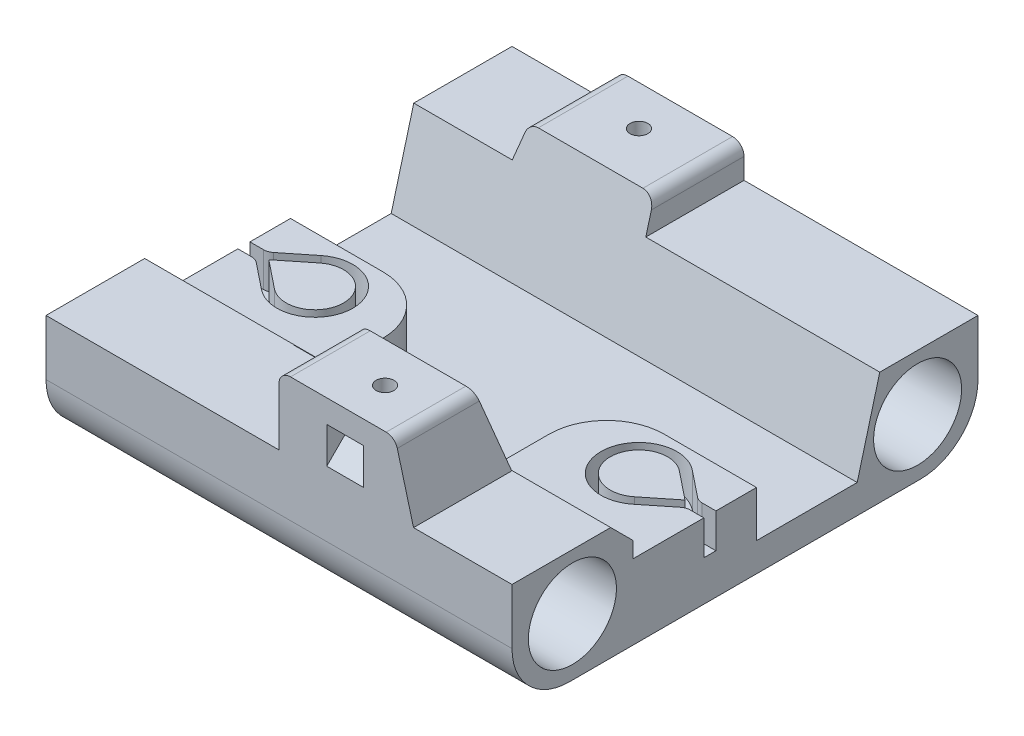
from build123d import *
from build123d.topology import SkipClean

# Parameters (mm, degrees)
SKETCH1_W                = 81
SKETCH1_H                = 81
BOSS_EXTRUDE1_DEPTH      = 5
BOSS_EXTRUDE3_DEPTH      = 81
SKETCH4_R                = 7.65
CUT_EXTRUDE2_DEPTH       = 93.668077028
BOSS_EXTRUDE4_DEPTH      = 10
BOSS_EXTRUDE6_DEPTH      = 26.053662708
CHAMFER1_SIZE            = 3.85
CHAMFER1_OF_MIRROR1_SIZE = 3.85
FILLET2_R                = 2
FILLET3_R                = 10
SKETCH8_R                = 7.65
SKETCH8_R_2              = 6
BOSS_EXTRUDE7_DEPTH      = 16.5
BOSS_EXTRUDE8_REACH      = 94.668
BOSS_EXTRUDE9_REACH      = 97.932
SKETCH11_R               = 1.55
CUT_EXTRUDE3_DEPTH       = 15
CUT_EXTRUDE4_DEPTH       = 2
BOSS_EXTRUDE10_START     = 2
BOSS_EXTRUDE10_DEPTH     = 2
FILLET4_R                = 10
CUT_EXTRUDE5_REACH       = 97.932
FILLET5_R                = 2
FILLET6_R                = 2
FILLET7_R                = 2
CUT_EXTRUDE6_DEPTH       = 2.5
CHAMFER2_SIZE            = 3.8
CUT_EXTRUDE7_REACH       = 97.932
SKETCH17_W               = 23.385
SKETCH17_H               = 12
CUT_EXTRUDE8_REACH       = 97.932
SKETCH19_W               = 23.550689655
SKETCH19_H               = 12
FILLET8_R                = 2


with BuildPart() as part:
    # Sketch1 → Boss-Extrude1 (new body)
    with BuildSketch(Plane(origin=(0, 0, 0), x_dir=(1, 0, 0), z_dir=(0, 1, 0))):
        Rectangle(SKETCH1_W, SKETCH1_H)
    extrude(amount=BOSS_EXTRUDE1_DEPTH)

    # Sketch2 → Boss-Extrude3 (add)
    with BuildSketch(Plane.ZY.offset(40.5)):
        with BuildLine():
            Line((-24.210138171, 5), (-19.5, 5))
            Line((-19.5, 5), (-23.425455669, 19.65))
            Line((-23.425455669, 19.65), (-40.5, 19.65))
            Line((-40.5, 19.65), (-40.5, 5))
            Line((-40.5, 5), (-35.789861829, 5))
            ThreePointArc((-35.789861829, 5), (-32.667401077, 17.169900383), (-22.35, 10))
            ThreePointArc((-22.35, 10), (-22.830099617, 7.332598923), (-24.210138171, 5))
        make_face()
        with BuildLine():
            Line((23.425455669, 19.65), (19.5, 5))
            Line((19.5, 5), (24.210138171, 5))
            ThreePointArc((24.210138171, 5), (27.332598923, 17.169900383), (37.65, 10))
            ThreePointArc((37.65, 10), (37.169900383, 7.332598923), (35.789861829, 5))
            Line((35.789861829, 5), (40.5, 5))
            Line((40.5, 5), (40.5, 19.65))
            Line((40.5, 19.65), (23.425455669, 19.65))
        make_face()
    extrude(amount=-BOSS_EXTRUDE3_DEPTH)

    # Sketch4 → Cut-Extrude2 (cut, through all)
    with SkipClean():  # the faces are left unmerged after this step: merging them gives an invalid solid
        with BuildSketch(Plane.ZY.offset(40.5)):
            with Locations((-30, 10)):
                Circle(SKETCH4_R)
            with Locations((30, 10)):
                Circle(SKETCH4_R)
        extrude(amount=-CUT_EXTRUDE2_DEPTH, mode=Mode.SUBTRACT)

    # Sketch6 → Boss-Extrude4 (add)
    with SkipClean():  # the faces are left unmerged after this step: merging them gives an invalid solid
        with BuildSketch(Plane(origin=(0, 5, 0), x_dir=(1, 0, 0), z_dir=(0, 1, 0))):
            with BuildLine():
                Line((-32.290875523, -0.947876651), (-37.414425943, -5.05))
                Line((-37.414425943, -5.05), (-40.5, -5.05))
                Line((-40.5, -5.05), (-40.5, 2))
                Line((-40.5, 2), (-14.446337292, 2))
                Line((-14.446337292, 2), (-14.446337292, -19.5))
                Line((-14.446337292, -19.5), (-40.5, -19.5))
                Line((-40.5, -19.5), (-40.5, -7.15))
                Line((-40.5, -7.15), (-37.414425943, -7.15))
                Line((-37.414425943, -7.15), (-32.290875523, -11.252123349))
                ThreePointArc((-32.290875523, -11.252123349), (-21.565875523, -6.1), (-32.290875523, -0.947876651))
            make_face()
            with BuildLine():
                Line((-31.290875523, -2.196876251), (-36.165875523, -6.1))
                Line((-36.165875523, -6.1), (-31.290875523, -10.003123749))
                ThreePointArc((-31.290875523, -10.003123749), (-23.165875523, -6.1), (-31.290875523, -2.196876251))
            make_face()
        boss_extrude4 = extrude(amount=BOSS_EXTRUDE4_DEPTH)

    # Sketch7 → Boss-Extrude6 (add)
    with SkipClean():  # the faces are left unmerged after this step: merging them gives an invalid solid
        with BuildSketch(Plane.ZY.offset(40.5)):
            Polygon((19.5, 5), (19.5, 19.65), (23.425455669, 19.65), align=None)
        boss_extrude6 = extrude(amount=-BOSS_EXTRUDE6_DEPTH)

    # Chamfer1
    chamfer1_edges = [part.edges().sort_by_distance(p)[0] for p in [
        (-27.473168646, 19.65, 19.5),
    ]]
    chamfer(chamfer1_edges, length=CHAMFER1_SIZE)

    # Mirror1: Boss-Extrude4, Boss-Extrude6 across plane
    with SkipClean():  # the faces are left unmerged after this step: merging them gives an invalid solid
        add(boss_extrude4.mirror(Plane.ZY))
        add(boss_extrude6.mirror(Plane.ZY))

    # Chamfer1 of Mirror1
    chamfer1_of_mirror1_edges = [part.edges().sort_by_distance(p)[0] for p in [
        (27.473168646, 19.65, 19.5),
    ]]
    chamfer(chamfer1_of_mirror1_edges, length=CHAMFER1_OF_MIRROR1_SIZE)

    # Fillet2
    fillet2_edges = [part.edges().sort_by_distance(p)[0] for p in [
        (37.414425943, 10, 7.15),
        (37.414425943, 10, 5.05),
        (-37.414425943, 10, 7.15),
        (-37.414425943, 10, 5.05),
    ]]
    fillet(fillet2_edges, radius=FILLET2_R)

    # Fillet3
    fillet3_edges = [part.edges().sort_by_distance(p)[0] for p in [
        (0, 0, 40.5),
        (0, 0, -40.5),
    ]]
    fillet(fillet3_edges, radius=FILLET3_R)

    # Sketch8 → Boss-Extrude7 (add, symmetric)
    # profile 1 of 2: a face of its own
    with SkipClean():  # the faces are left unmerged after this step: merging them gives an invalid solid
        with BuildSketch(Plane.ZY):
            with Locations((30, 10)):
                Circle(SKETCH8_R)
            with Locations((30, 10)):
                Circle(SKETCH8_R_2, mode=Mode.SUBTRACT)
        # profile 2 of 2: a face of its own
        with BuildSketch(Plane.ZY):
            with Locations((-30, 10)):
                Circle(SKETCH8_R)
            with Locations((-30, 10)):
                Circle(SKETCH8_R_2, mode=Mode.SUBTRACT)
        extrude(amount=BOSS_EXTRUDE7_DEPTH, both=True)

    # Boss-Extrude8: up to this plane
    with SkipClean():  # the faces are left unmerged after this step: merging them gives an invalid solid
        boss_extrude8_end = Plane(origin=(66.10512644, -4.540063509, 16.943747687), z_dir=(0, -0.25881904510252485, 0.9659258262890673))
        # Sketch9 → Boss-Extrude8 (add, up to the surface)
        with BuildSketch(Plane.XY.offset(40.5), mode=Mode.PRIVATE) as boss_extrude8_sk1:
            Polygon((-20.165689655, 31.65), (-23.385, 19.65), (23.385, 19.65), (20.165689655, 31.65), align=None)
        boss_extrude8_tool1 = split(extrude(boss_extrude8_sk1.sketch, amount=-BOSS_EXTRUDE8_REACH, mode=Mode.PRIVATE), bisect_by=boss_extrude8_end, keep=Keep.BOTH, mode=Mode.PRIVATE)
        add(boss_extrude8_tool1.solids().sort_by_distance((0, 25.502158, 40.5))[0])

    # Boss-Extrude9: up to this plane
    with SkipClean():  # the faces are left unmerged after this step: merging them gives an invalid solid
        boss_extrude9_end = Plane(origin=(66.10512644, -4.540063509, -16.943747687), z_dir=(0, 0.25881904510252485, 0.9659258262890673))
        # Sketch10 → Boss-Extrude9 (add, up to the surface)
        with BuildSketch(Plane(origin=(0, 0, -40.5), x_dir=(-1, 0, 0), z_dir=(0, 0, -1)), mode=Mode.PRIVATE) as boss_extrude9_sk1:
            Polygon((23.385, 19.65), (20.165689655, 31.65), (-20.165689655, 31.65), (-23.385, 19.65), align=None)
        boss_extrude9_tool1 = split(extrude(boss_extrude9_sk1.sketch, amount=-BOSS_EXTRUDE9_REACH, mode=Mode.PRIVATE), bisect_by=boss_extrude9_end, keep=Keep.BOTH, mode=Mode.PRIVATE)
        add(boss_extrude9_tool1.solids().sort_by_distance((0, 25.502158, -40.5))[0])

    # Sketch11 → Cut-Extrude3 (cut)
    with SkipClean():  # the faces are left unmerged after this step: merging them gives an invalid solid
        with BuildSketch(Plane(origin=(0, 31.65, 0), x_dir=(1, 0, 0), z_dir=(0, 1, 0))):
            with Locations(Location((-11.5, 33.570422989, 0), (0, 0, 270))):
                Circle(SKETCH11_R)
            with BuildLine():
                ThreePointArc((13.05, -33.570422989), (11.5, -32.020422989), (9.95, -33.570422989))
                Line((9.95, -33.570422989), (13.05, -33.570422989))
            make_face()
            with BuildLine():
                Line((13.05, -33.570422989), (9.95, -33.570422989))
                ThreePointArc((9.95, -33.570422989), (11.5, -35.120422989), (13.05, -33.570422989))
            make_face()
        extrude(amount=-CUT_EXTRUDE3_DEPTH, mode=Mode.SUBTRACT)

    # Sketch12 → Cut-Extrude4 (cut)
    with SkipClean():  # the faces are left unmerged after this step: merging them gives an invalid solid
        with BuildSketch(Plane(origin=(0, 15, 0), x_dir=(1, 0, 0), z_dir=(0, 1, 0))):
            with BuildLine():
                Line((31.290875523, -10.003123749), (36.165875523, -6.1))
                Line((36.165875523, -6.1), (31.290875523, -2.196876251))
                ThreePointArc((31.290875523, -2.196876251), (23.165875523, -6.1), (31.290875523, -10.003123749))
            make_face()
            with BuildLine():
                Line((-36.165875523, -6.1), (-31.290875523, -10.003123749))
                ThreePointArc((-31.290875523, -10.003123749), (-23.165875523, -6.1), (-31.290875523, -2.196876251))
                Line((-31.290875523, -2.196876251), (-36.165875523, -6.1))
            make_face()
            with BuildLine():
                Line((32.290875523, -0.947876651), (36.866426744, -4.6112495))
                ThreePointArc((36.866426744, -4.6112495), (37.454044301, -4.937127314), (38.116426744, -5.05))
                Line((38.116426744, -5.05), (40.5, -5.05))
                Line((40.5, -5.05), (40.5, 2))
                Line((40.5, 2), (14.446337292, 2))
                Line((14.446337292, 2), (14.446337292, -19.5))
                Line((14.446337292, -19.5), (40.5, -19.5))
                Line((40.5, -19.5), (40.5, -7.15))
                Line((40.5, -7.15), (38.116426744, -7.15))
                ThreePointArc((38.116426744, -7.15), (37.454044301, -7.262872686), (36.866426744, -7.5887505))
                Line((36.866426744, -7.5887505), (32.290875523, -11.252123349))
                ThreePointArc((32.290875523, -11.252123349), (21.565875523, -6.1), (32.290875523, -0.947876651))
            make_face()
            with BuildLine():
                Line((-32.290875523, -11.252123349), (-36.866426744, -7.5887505))
                ThreePointArc((-36.866426744, -7.5887505), (-37.454044301, -7.262872686), (-38.116426744, -7.15))
                Line((-38.116426744, -7.15), (-40.5, -7.15))
                Line((-40.5, -7.15), (-40.5, -19.5))
                Line((-40.5, -19.5), (-14.446337292, -19.5))
                Line((-14.446337292, -19.5), (-14.446337292, 2))
                Line((-14.446337292, 2), (-40.5, 2))
                Line((-40.5, 2), (-40.5, -5.05))
                Line((-40.5, -5.05), (-38.116426744, -5.05))
                ThreePointArc((-38.116426744, -5.05), (-37.454044301, -4.937127314), (-36.866426744, -4.6112495))
                Line((-36.866426744, -4.6112495), (-32.290875523, -0.947876651))
                ThreePointArc((-32.290875523, -0.947876651), (-21.565875523, -6.1), (-32.290875523, -11.252123349))
            make_face()
        extrude(amount=-CUT_EXTRUDE4_DEPTH, mode=Mode.SUBTRACT)

    # Sketch13 → Boss-Extrude10 (add)
    with SkipClean():  # the faces are left unmerged after this step: merging them gives an invalid solid
        with BuildSketch(Plane(origin=(0, 5, 0), x_dir=(1, 0, 0), z_dir=(0, 1, 0)).offset(BOSS_EXTRUDE10_START)):
            with BuildLine():
                Line((32.290875523, -11.252123349), (36.866426744, -7.5887505))
                ThreePointArc((36.866426744, -7.5887505), (37.454044301, -7.262872686), (38.116426744, -7.15))
                Line((38.116426744, -7.15), (40.5, -7.15))
                Line((40.5, -7.15), (40.5, -5.05))
                Line((40.5, -5.05), (38.116426744, -5.05))
                ThreePointArc((38.116426744, -5.05), (37.454044301, -4.937127314), (36.866426744, -4.6112495))
                Line((36.866426744, -4.6112495), (32.290875523, -0.947876651))
                ThreePointArc((32.290875523, -0.947876651), (21.565875523, -6.1), (32.290875523, -11.252123349))
            make_face()
            with BuildLine():
                Line((-40.5, -7.15), (-38.116426744, -7.15))
                ThreePointArc((-38.116426744, -7.15), (-37.454044301, -7.262872686), (-36.866426744, -7.5887505))
                Line((-36.866426744, -7.5887505), (-32.290875523, -11.252123349))
                ThreePointArc((-32.290875523, -11.252123349), (-21.565875523, -6.1), (-32.290875523, -0.947876651))
                Line((-32.290875523, -0.947876651), (-36.866426744, -4.6112495))
                ThreePointArc((-36.866426744, -4.6112495), (-37.454044301, -4.937127314), (-38.116426744, -5.05))
                Line((-38.116426744, -5.05), (-40.5, -5.05))
                Line((-40.5, -5.05), (-40.5, -7.15))
            make_face()
        extrude(amount=-BOSS_EXTRUDE10_DEPTH)

    # Fillet4
    fillet4_edges = [part.edges().sort_by_distance(p)[0] for p in [
        (14.446337292, 9, -2),
        (-14.446337292, 9, -2),
    ]]
    fillet(fillet4_edges, radius=FILLET4_R)

    # Cut-Extrude5: up to this plane
    with SkipClean():  # the faces are left unmerged after this step: merging them gives an invalid solid
        cut_extrude5_end = Plane(origin=(66.10512644, -4.540063509, -16.943747687), z_dir=(0, 0.25881904510252485, 0.9659258262890673))
        # Sketch15 → Cut-Extrude5 (cut, up to the surface)
        with BuildSketch(Plane(origin=(0, 0, -40.5), x_dir=(-1, 0, 0), z_dir=(0, 0, -1)), mode=Mode.PRIVATE) as cut_extrude5_sk1:
            Polygon((20.165689655, 31.65), (0.165689655, 31.65), (0.165689655, 25.25), (21.882655172, 25.25), align=None)
        cut_extrude5_tool1 = split(extrude(cut_extrude5_sk1.sketch, amount=-CUT_EXTRUDE5_REACH, mode=Mode.PRIVATE), bisect_by=cut_extrude5_end, keep=Keep.BOTH, mode=Mode.PRIVATE)
        add(cut_extrude5_tool1.solids().sort_by_distance((-10.60082, 28.406099, -40.5))[0], mode=Mode.SUBTRACT)

    # Fillet5
    fillet5_edges = [part.edges().sort_by_distance(p)[0] for p in [
        (-0.165689655, 31.65, -33.570422989),
    ]]
    fillet(fillet5_edges, radius=FILLET5_R)

    # Fillet6
    fillet6_edges = [part.edges().sort_by_distance(p)[0] for p in [
        (20.165689655, 31.65, 33.570422989),
        (-20.165689655, 31.65, 33.570422989),
        (20.165689655, 31.65, -33.570422989),
    ]]
    fillet(fillet6_edges, radius=FILLET6_R)

    # Fillet7
    fillet7_edges = [part.edges().sort_by_distance(p)[0] for p in [
        (-21.882655172, 25.25, -32.712985573),
    ]]
    fillet(fillet7_edges, radius=FILLET7_R)

    # Sketch16 → Cut-Extrude6 (cut)
    with SkipClean():  # the faces are left unmerged after this step: merging them gives an invalid solid
        with BuildSketch(Plane(origin=(0, 27.65, 0), x_dir=(1, 0, 0), z_dir=(0, 1, 0))):
            Polygon((-14.7, -30.567073624), (-8.3, -30.567073624), (-8.3, -36.567073624), (-8.3, -40.5), (-14.7, -40.5), (-14.7, -36.567073624), align=None)
            Polygon((14.7, -36.567073624), (14.7, -40.5), (8.3, -40.5), (8.3, -36.567073624), (8.3, -30.567073624), (14.7, -30.567073624), align=None)
            Polygon((14.7, 40.5), (8.3, 40.5), (8.3, 36.567073624), (8.3, 30.567073624), (14.7, 30.567073624), (14.7, 36.567073624), align=None)
        extrude(amount=-CUT_EXTRUDE6_DEPTH, mode=Mode.SUBTRACT)

    # Chamfer2
    chamfer2_edges = [part.edges().sort_by_distance(p)[0] for p in [
        (-11.5, 25.15, 40.5),
        (11.5, 25.15, 40.5),
        (11.5, 25.15, -40.5),
    ]]
    chamfer(chamfer2_edges, length=CHAMFER2_SIZE)

    # Cut-Extrude7: up to this plane
    with SkipClean():  # the faces are left unmerged after this step: merging them gives an invalid solid
        cut_extrude7_end = Plane(origin=(66.10512644, -4.540063509, 16.943747687), z_dir=(0, -0.25881904510252485, 0.9659258262890673))
        # Sketch17 → Cut-Extrude7 (cut, up to the surface)
        with BuildSketch(Plane.XY.offset(40.5), mode=Mode.PRIVATE) as cut_extrude7_sk1:
            with Locations((-11.6925, 25.65)):
                Rectangle(SKETCH17_W, SKETCH17_H)
        cut_extrude7_tool1 = split(extrude(cut_extrude7_sk1.sketch, amount=-CUT_EXTRUDE7_REACH, mode=Mode.PRIVATE), bisect_by=cut_extrude7_end, keep=Keep.BOTH, mode=Mode.PRIVATE)
        add(cut_extrude7_tool1.solids().sort_by_distance((-11.6925, 25.65, 40.5))[0], mode=Mode.SUBTRACT)

    # Cut-Extrude8: up to this plane
    with SkipClean():  # the faces are left unmerged after this step: merging them gives an invalid solid
        cut_extrude8_end = Plane(origin=(66.10512644, -4.540063509, -16.943747687), z_dir=(0, 0.25881904510252485, 0.9659258262890673))
        # Sketch19 → Cut-Extrude8 (cut, up to the surface)
        with BuildSketch(Plane(origin=(0, 0, -40.5), x_dir=(-1, 0, 0), z_dir=(0, 0, -1)), mode=Mode.PRIVATE) as cut_extrude8_sk1:
            with Locations((-11.609655173, 25.65)):
                Rectangle(SKETCH19_W, SKETCH19_H)
        cut_extrude8_tool1 = split(extrude(cut_extrude8_sk1.sketch, amount=-CUT_EXTRUDE8_REACH, mode=Mode.PRIVATE), bisect_by=cut_extrude8_end, keep=Keep.BOTH, mode=Mode.PRIVATE)
        add(cut_extrude8_tool1.solids().sort_by_distance((11.609655, 25.65, -40.5))[0], mode=Mode.SUBTRACT)

    # Fillet8
    fillet8_edges = [part.edges().sort_by_distance(p)[0] for p in [
        (-0.165689655, 25.25, -32.712985573),
        (0, 31.65, 33.570422989),
    ]]
    fillet(fillet8_edges, radius=FILLET8_R)


solid = part.part
